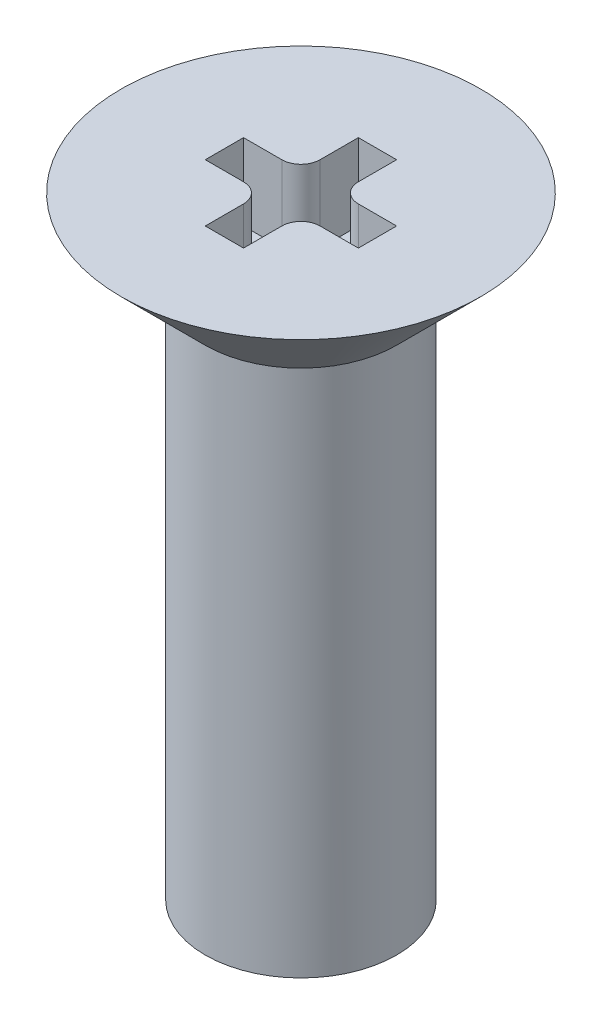
from build123d import *

# Parameters (mm, degrees)
BOSS_EXTRUDE1_START = 6.5
SKETCH2_R           = 1.25
BOSS_EXTRUDE1_DEPTH = 6.5
CUT_EXTRUDE1_DEPTH  = 1


with BuildPart() as part:
    # Sketch1 → Revolve1 (revolve)
    with BuildSketch(Plane(origin=(0, 0, 0), x_dir=(0, 0, -1), z_dir=(1, 0, 0))):
        Polygon((0, 0), (-2.35, 0), (-1.25, -1.1), (-1.25, -1.5), (0, -1.5), align=None)
    revolve(axis=Axis((0, 0.872326939, 0), (0, -1, 0)))

    # Sketch2 → Boss-Extrude1 (add)
    with BuildSketch(Plane.XZ.offset(1.5).offset(BOSS_EXTRUDE1_START)):
        with Locations(Location((0, 0, 0), (0, 0, 90))):
            Circle(SKETCH2_R)
    extrude(amount=-BOSS_EXTRUDE1_DEPTH)

    # Sketch3 → Cut-Extrude1 (cut)
    with BuildSketch(Plane(origin=(0, 0, 0), x_dir=(1, 0, 0), z_dir=(0, 1, 0))):
        with BuildLine():
            Line((-1, -0.25), (-0.5, -0.25))
            ThreePointArc((-0.5, -0.25), (-0.323223305, -0.323223305), (-0.25, -0.5))
            Line((-0.25, -0.5), (-0.25, -1))
            Line((-0.25, -1), (0.25, -1))
            Line((0.25, -1), (0.25, -0.5))
            ThreePointArc((0.25, -0.5), (0.323223305, -0.323223305), (0.5, -0.25))
            Line((0.5, -0.25), (1, -0.25))
            Line((1, -0.25), (1, 0.25))
            Line((1, 0.25), (0.5, 0.25))
            ThreePointArc((0.5, 0.25), (0.323223305, 0.323223305), (0.25, 0.5))
            Line((0.25, 0.5), (0.25, 1))
            Line((0.25, 1), (-0.25, 1))
            Line((-0.25, 1), (-0.25, 0.5))
            ThreePointArc((-0.25, 0.5), (-0.323223305, 0.323223305), (-0.5, 0.25))
            Line((-0.5, 0.25), (-1, 0.25))
            Line((-1, 0.25), (-1, -0.25))
        make_face()
    extrude(amount=-CUT_EXTRUDE1_DEPTH, mode=Mode.SUBTRACT)


solid = part.part
